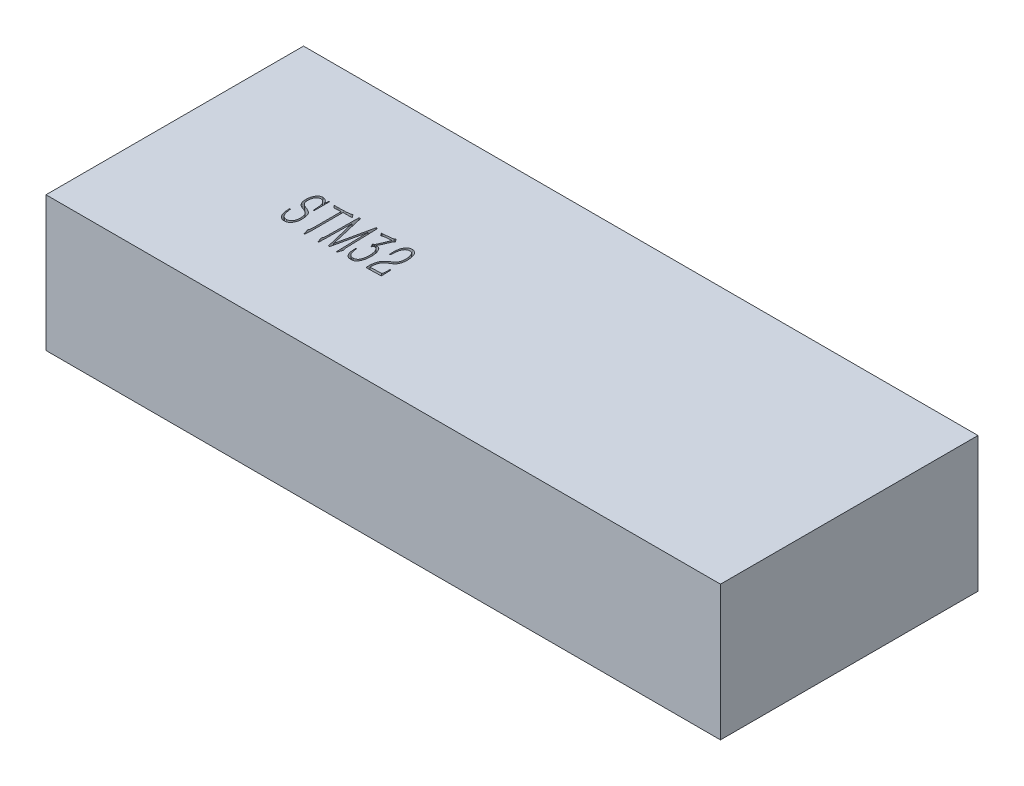
from build123d import *

# Parameters (mm, degrees)
SKETCH_1_W          = 55
SKETCH_1_H          = 21
EXTRUDE_1_DEPTH     = 11
CUT_EXTRUDE_1_DEPTH = 2


with BuildPart() as part:
    # 草图1 → 凸台-拉伸1 (new body)
    with BuildSketch(Plane(origin=(0, 0, 0), x_dir=(1, 0, 0), z_dir=(0, 1, 0))):
        Rectangle(SKETCH_1_W, SKETCH_1_H)
    extrude(amount=EXTRUDE_1_DEPTH)

    # 草图2 → 切除-拉伸1 (cut)
    with BuildSketch(Plane(origin=(0, 11, 0), x_dir=(1, 0, 0), z_dir=(0, 1, 0))):
        with BuildLine():
            Line((-15.545726401, 0.272778651), (-15.495012572, 0.580044792))
            Line((-15.495012572, 0.580044792), (-15.445044534, 0.574824251))
            Line((-15.445044534, 0.574824251), (-15.445044534, -0.683326186))
            Line((-15.445044534, -0.683326186), (-15.505453654, -0.688546727))
            Line((-15.505453654, -0.688546727), (-15.54050586, -0.15530573))
            add(Edge.make_bspline(
                [(-15.54050586, -0.15530573), (-15.545120979, -0.125653537), (-15.553652171, -0.070840527), (-15.570375119, 0.003388602), (-15.585885686, 0.064132898), (-15.60992007, 0.125691805), (-15.645585765, 0.191413941), (-15.698121168, 0.261857732), (-15.761154224, 0.325313201), (-15.835904039, 0.375229564), (-15.916922097, 0.413379867), (-15.975170709, 0.420630339), (-16.003642446, 0.424174347)],
                knots=[0, 0, 0, 0, 1.116474761, 2.063838624, 2.831507158, 3.446633667, 4.518832044, 5.603216916, 6.708904972, 7.82779241, 8.938231816, 10, 10, 10, 10], degree=3))
            add(Edge.make_bspline(
                [(-16.003642446, 0.424174347), (-16.020605721, 0.423447236), (-16.055433312, 0.421954394), (-16.099151463, 0.411672424), (-16.136409888, 0.398035989), (-16.167222762, 0.380492305), (-16.201114315, 0.356995795), (-16.236518518, 0.327827061), (-16.272117942, 0.29449713), (-16.303691267, 0.255762697), (-16.331408441, 0.213346819), (-16.361130077, 0.152206722), (-16.390726277, 0.074279981), (-16.410291414, -0.006431397), (-16.418843362, -0.073901542), (-16.424096383, -0.13086507), (-16.427469619, -0.194799251), (-16.430429041, -0.263930122), (-16.427885653, -0.335151778), (-16.417623197, -0.404800149), (-16.399146827, -0.471065886), (-16.380546117, -0.512245668), (-16.371317707, -0.532676282)],
                knots=[0, 0, 0, 0, 0.864038106, 1.773971445, 2.275285977, 2.88209936, 3.574564674, 4.376127188, 5.218616224, 6.055847121, 6.916999662, 7.795414815, 9.515900782, 11.157236165, 12.013901558, 12.981067707, 14.072720019, 15.277182195, 16.507433409, 17.699229733, 18.858513907, 20, 20, 20, 20], degree=3))
            add(Edge.make_bspline(
                [(-16.371317707, -0.532676282), (-16.360869244, -0.551621911), (-16.340493141, -0.588568785), (-16.302385021, -0.63775803), (-16.257630675, -0.677624712), (-16.194768088, -0.71824204), (-16.119363047, -0.754543277), (-16.059926532, -0.77854607), (-16.03347411, -0.789228594)],
                knots=[0, 0, 0, 0, 0.892298636, 1.740118821, 2.553971753, 3.353728668, 4.822268012, 6, 6, 6, 6], degree=3))
            Line((-16.03347411, -0.789228594), (-15.857467292, -0.860078796))
            add(Edge.make_bspline(
                [(-15.857467292, -0.860078796), (-15.835752482, -0.87009329), (-15.793941997, -0.889375559), (-15.735013974, -0.920050934), (-15.68166264, -0.950384812), (-15.620276832, -0.991470311), (-15.552636998, -1.045431435), (-15.485801386, -1.119851507), (-15.431491132, -1.204190544), (-15.397424367, -1.302528667), (-15.370592973, -1.409209074), (-15.352476138, -1.52510209), (-15.340514785, -1.651627752), (-15.335707041, -1.78699432), (-15.337836275, -1.926879032), (-15.355717701, -2.018196036), (-15.364499041, -2.063040654)],
                knots=[0, 0, 0, 0, 0.703245545, 1.354054533, 1.953549274, 2.507188807, 3.525842386, 4.488918984, 5.43838142, 6.454223102, 7.53246407, 8.673253088, 9.899948524, 11.268249991, 12.658472344, 14, 14, 14, 14], degree=3))
            add(Edge.make_bspline(
                [(-15.364499041, -2.063040654), (-15.375478458, -2.108014042), (-15.396744921, -2.195124765), (-15.442755466, -2.295208406), (-15.483086666, -2.365981189), (-15.512964946, -2.411846993), (-15.542841349, -2.451262441), (-15.58188771, -2.497519015), (-15.642108178, -2.546279928), (-15.712367212, -2.585108604), (-15.777040362, -2.609249164), (-15.830721407, -2.623050475), (-15.888357879, -2.63004591), (-15.928053201, -2.631389259), (-15.948453868, -2.632079649)],
                knots=[0, 0, 0, 0, 1.868422262, 3.619020558, 4.429541533, 5.162879566, 5.830420081, 6.429075538, 7.606854402, 8.938752151, 9.657684361, 10.394048182, 11.174651193, 12, 12, 12, 12], degree=3))
            add(Edge.make_bspline(
                [(-15.948453868, -2.632079649), (-15.97136282, -2.631933914), (-16.016202718, -2.631648667), (-16.081806483, -2.621037822), (-16.143714519, -2.601617245), (-16.201364512, -2.572741374), (-16.255282029, -2.536675352), (-16.305357401, -2.493892905), (-16.351669384, -2.444845493), (-16.395401464, -2.390481897), (-16.433707271, -2.329095792), (-16.468320405, -2.262332489), (-16.497926072, -2.189848634), (-16.531118605, -2.087549624), (-16.56028594, -1.957593639), (-16.568628609, -1.852380075), (-16.572681441, -1.801267801)],
                knots=[0, 0, 0, 0, 0.833862414, 1.63212638, 2.411403016, 3.189256699, 3.973153178, 4.770028097, 5.583768076, 6.428386665, 7.307987397, 8.215552436, 9.166047206, 10.157242313, 12.13320567, 14, 14, 14, 14], degree=3))
            Line((-16.572681441, -1.801267801), (-16.592817814, -1.534274407))
            Line((-16.592817814, -1.534274407), (-16.521967611, -1.534274407))
            add(Edge.make_bspline(
                [(-16.521967611, -1.534274407), (-16.517892088, -1.565867601), (-16.510051357, -1.626648435), (-16.4962746, -1.714325665), (-16.482995543, -1.795147118), (-16.46602113, -1.891736073), (-16.439466365, -2.000843932), (-16.397632102, -2.119417828), (-16.343002913, -2.223476033), (-16.284637844, -2.296573811), (-16.234445776, -2.347428978), (-16.19443194, -2.376625966), (-16.155453469, -2.401848059), (-16.102626388, -2.423420595), (-16.036803822, -2.440657247), (-15.983863095, -2.440491643), (-15.958149158, -2.440411206)],
                knots=[0, 0, 0, 0, 1.134650933, 2.182907786, 3.161205505, 4.052250561, 5.675932663, 7.155002512, 8.52184542, 9.839854562, 10.472309825, 11.060302883, 11.600982628, 12.120735338, 13.087218943, 14, 14, 14, 14], degree=3))
            add(Edge.make_bspline(
                [(-15.958149158, -2.440411206), (-15.935452235, -2.439599929), (-15.891913495, -2.438043683), (-15.829650689, -2.42482848), (-15.772932978, -2.404576341), (-15.722958374, -2.373491794), (-15.678140584, -2.335971266), (-15.637700555, -2.292087322), (-15.600637256, -2.242659406), (-15.569730011, -2.187168973), (-15.542444046, -2.129809318), (-15.520017895, -2.07279896), (-15.503382594, -2.017135214), (-15.4921044, -1.962187229), (-15.484454926, -1.905365069), (-15.480556711, -1.844830094), (-15.477713804, -1.779153065), (-15.479279583, -1.733898767), (-15.48009674, -1.710281226)],
                knots=[0, 0, 0, 0, 1.108065456, 2.12556444, 3.098260599, 4.035950869, 4.98490885, 5.94776606, 6.946521194, 7.996930623, 9.045863326, 10.049925535, 10.987930625, 11.881525266, 12.788809675, 13.787786499, 14.845478855, 16, 16, 16, 16], degree=3))
            add(Edge.make_bspline(
                [(-15.48009674, -1.710281226), (-15.482707716, -1.673419561), (-15.487580906, -1.604620057), (-15.503383523, -1.509928575), (-15.522673874, -1.430391778), (-15.548415258, -1.365015626), (-15.579688609, -1.310965324), (-15.61255593, -1.262382964), (-15.649601102, -1.219062678), (-15.691810149, -1.18132547), (-15.738182166, -1.146342538), (-15.790394757, -1.113810968), (-15.848875154, -1.082908428), (-15.890874239, -1.065335624), (-15.912655871, -1.056221988)],
                knots=[0, 0, 0, 0, 1.578487453, 2.946127177, 4.097996722, 5.070650713, 5.936469873, 6.761635482, 7.575228913, 8.364955199, 9.176673428, 10.055112166, 10.991339211, 12, 12, 12, 12], degree=3))
            Line((-15.912655871, -1.056221988), (-16.129681227, -0.975676495))
            add(Edge.make_bspline(
                [(-16.129681227, -0.975676495), (-16.163452205, -0.96091396), (-16.230372316, -0.93166072), (-16.321712596, -0.872496394), (-16.401303358, -0.800874915), (-16.465395672, -0.713936779), (-16.5146133, -0.612713596), (-16.54468236, -0.517880559), (-16.561430498, -0.432680254), (-16.568882054, -0.360057104), (-16.573777286, -0.280167206), (-16.573058352, -0.224672432), (-16.572681441, -0.195578477)],
                knots=[0, 0, 0, 0, 1.141640751, 2.262259852, 3.359181592, 4.444772656, 5.58953336, 6.835542724, 7.519006772, 8.279340868, 9.097919025, 10, 10, 10, 10], degree=3))
            add(Edge.make_bspline(
                [(-16.572681441, -0.195578477), (-16.572468898, -0.170461033), (-16.572058036, -0.121906824), (-16.566836172, -0.051664567), (-16.557963401, 0.013073148), (-16.542065385, 0.092106688), (-16.513616721, 0.18492111), (-16.46942435, 0.288825364), (-16.418213621, 0.381634216), (-16.359340685, 0.459461193), (-16.292126294, 0.520310992), (-16.230932026, 0.562435919), (-16.175342084, 0.587454941), (-16.127674647, 0.600982501), (-16.074692853, 0.607870475), (-16.037717327, 0.609191803), (-16.018558278, 0.609876456)],
                knots=[0, 0, 0, 0, 0.971164436, 1.877345498, 2.721647718, 3.496542433, 4.992871533, 6.466013358, 7.856401207, 9.083219229, 10.219456221, 11.349985082, 11.939558551, 12.569451447, 13.258754286, 14, 14, 14, 14], degree=3))
            add(Edge.make_bspline(
                [(-16.018558278, 0.609876456), (-15.997084088, 0.607433607), (-15.95437485, 0.602575113), (-15.89173061, 0.585596928), (-15.831129529, 0.56121916), (-15.774533565, 0.528125929), (-15.72248285, 0.491277435), (-15.67564842, 0.453030371), (-15.637369715, 0.411647736), (-15.616304478, 0.382372297), (-15.606135521, 0.368239976)],
                knots=[0, 0, 0, 0, 1.049956055, 2.088219507, 3.145806661, 4.218152357, 5.268178035, 6.24663062, 7.15358473, 8, 8, 8, 8], degree=3))
            Line((-15.606135521, 0.368239976), (-15.545726401, 0.272778651))
        make_face()
        with BuildLine():
            Line((-14.133942894, 0.348103603), (-14.133942894, -2.077956487))
            Line((-14.133942894, -2.077956487), (-14.159299808, -2.576145278))
            add(Edge.make_bspline(
                [(-14.159299808, -2.576145278), (-14.159598209, -2.600377953), (-14.160133601, -2.643856455), (-14.168563762, -2.693031821), (-14.17675315, -2.723708784), (-14.182506683, -2.735483575), (-14.187975315, -2.745527316), (-14.192509124, -2.743344195), (-14.194352014, -2.742456806)],
                knots=[0, 0, 0, 0, 2.43675652, 4.372052466, 5.078871199, 5.550454925, 5.817270194, 6, 6, 6, 6], degree=3))
            add(Edge.make_bspline(
                [(-14.194352014, -2.742456806), (-14.196609085, -2.741778683), (-14.202171392, -2.740107521), (-14.213118622, -2.733997853), (-14.224282951, -2.714773084), (-14.235074558, -2.686138484), (-14.247159127, -2.653672236), (-14.252449231, -2.631380562), (-14.254761134, -2.621638566)],
                knots=[0, 0, 0, 0, 0.30288637, 0.746430801, 1.570370807, 3.058663464, 4.714565407, 6, 6, 6, 6], degree=3))
            Line((-14.254761134, -2.621638566), (-14.315170254, -2.440411206))
            add(Edge.make_bspline(
                [(-14.315170254, -2.440411206), (-14.320947349, -2.424527366), (-14.331103186, -2.396604386), (-14.343593289, -2.35997794), (-14.350187736, -2.333866008), (-14.352233431, -2.310851551), (-14.342101732, -2.286708012), (-14.330084437, -2.255223705), (-14.31670834, -2.218483973), (-14.306845661, -2.177753628), (-14.300550197, -2.133232653), (-14.294327892, -2.081265757), (-14.288361299, -2.016092298), (-14.281759409, -1.934584121), (-14.275096429, -1.83716293), (-14.274966096, -1.767223914), (-14.274897507, -1.730417599)],
                knots=[0, 0, 0, 0, 0.980641267, 1.723917205, 2.241620292, 2.544775778, 3.041991924, 3.722164793, 4.515637936, 5.302532678, 6.148880555, 7.121858782, 8.338588997, 9.944421189, 11.865699026, 14, 14, 14, 14], degree=3))
            Line((-14.274897507, -1.730417599), (-14.274897507, 0.343628853))
            add(Edge.make_bspline(
                [(-14.274897507, 0.343628853), (-14.289075041, 0.343566677), (-14.315213007, 0.343452049), (-14.348977405, 0.340840806), (-14.381315662, 0.338928011), (-14.418848176, 0.335816213), (-14.470804227, 0.331341161), (-14.531410294, 0.325519716), (-14.590913297, 0.321311333), (-14.638307783, 0.316336457), (-14.668910323, 0.314075978), (-14.683590784, 0.313290766), (-14.688066056, 0.313051398)],
                knots=[0, 0, 0, 0, 1.025992475, 1.891538789, 2.450608741, 3.371279513, 4.617765367, 6.225964987, 7.778834079, 8.935698997, 9.675552692, 10, 10, 10, 10], degree=3))
            Line((-14.688066056, 0.313051398), (-14.788747923, 0.298135565))
            Line((-14.788747923, 0.298135565), (-14.9595342, 0.44431072))
            add(Edge.make_bspline(
                [(-14.9595342, 0.44431072), (-14.967634208, 0.452157247), (-14.980149415, 0.464280805), (-14.991933044, 0.484285113), (-14.988341813, 0.497793867), (-14.982925112, 0.50892385), (-14.967840177, 0.514378725), (-14.95652099, 0.514401617), (-14.949838909, 0.514415131)],
                knots=[0, 0, 0, 0, 1.88901374, 2.918688365, 3.546721585, 4.117087209, 4.888455958, 6, 6, 6, 6], degree=3))
            add(Edge.make_bspline(
                [(-14.949838909, 0.514415131), (-14.946619655, 0.513584962), (-14.935904757, 0.510821847), (-14.912231318, 0.510909246), (-14.875314083, 0.508471801), (-14.845941506, 0.508930401), (-14.829020669, 0.50919459)],
                knots=[0, 0, 0, 0, 0.328519165, 1.093436259, 2.325598431, 4, 4, 4, 4], degree=3))
            Line((-14.829020669, 0.50919459), (-14.748475176, 0.50471984))
            add(Edge.make_bspline(
                [(-14.748475176, 0.50471984), (-14.745507486, 0.50384695), (-14.736061861, 0.501068696), (-14.715063593, 0.503365063), (-14.68285755, 0.501698821), (-14.65724953, 0.503619207), (-14.642572768, 0.50471984)],
                knots=[0, 0, 0, 0, 0.347341643, 1.105526146, 2.341086076, 4, 4, 4, 4], degree=3))
            Line((-14.642572768, 0.50471984), (-14.53667036, 0.50471984))
            Line((-14.53667036, 0.50471984), (-14.274897507, 0.514415131))
            Line((-14.274897507, 0.514415131), (-14.063838483, 0.519635672))
            add(Edge.make_bspline(
                [(-14.063838483, 0.519635672), (-14.045660299, 0.520304858), (-14.003394502, 0.521860773), (-13.935075122, 0.533032156), (-13.858614602, 0.543686551), (-13.794209098, 0.551365302), (-13.747441511, 0.555274986), (-13.721219802, 0.560137133), (-13.70283532, 0.563615948), (-13.694132919, 0.567997473), (-13.690942681, 0.56960371)],
                knots=[0, 0, 0, 0, 1.156915626, 2.689925566, 4.399695503, 6.072075551, 6.820020126, 7.381954211, 7.77342877, 8, 8, 8, 8], degree=3))
            Line((-13.690942681, 0.56960371), (-13.585040273, 0.609876456))
            Line((-13.585040273, 0.609876456), (-13.43961091, 0.428649096))
            add(Edge.make_bspline(
                [(-13.43961091, 0.428649096), (-13.432887094, 0.419203063), (-13.422245227, 0.404252707), (-13.411916073, 0.384246226), (-13.410595086, 0.37151166), (-13.41293507, 0.362370021), (-13.422257814, 0.360094746), (-13.434065581, 0.360326179), (-13.452279964, 0.35780247), (-13.466463539, 0.358272791), (-13.474663115, 0.358544685)],
                knots=[0, 0, 0, 0, 2.075716626, 3.285262792, 3.906827215, 4.383787294, 4.762155351, 5.472092002, 6.53860716, 8, 8, 8, 8], degree=3))
            Line((-13.474663115, 0.358544685), (-13.580565523, 0.358544685))
            Line((-13.580565523, 0.358544685), (-13.957936075, 0.353324144))
            add(Edge.make_bspline(
                [(-13.957936075, 0.353324144), (-13.976828514, 0.354176131), (-14.010874857, 0.355711509), (-14.055865444, 0.356373024), (-14.089034301, 0.356379287), (-14.106853675, 0.354181635), (-14.11380652, 0.353324144)],
                knots=[0, 0, 0, 0, 1.454015493, 2.620302767, 3.461663352, 4, 4, 4, 4], degree=3))
            Line((-14.11380652, 0.353324144), (-14.133942894, 0.348103603))
        make_face()
        with BuildLine():
            Line((-11.710865971, 0.635233371), (-11.595268272, 0.635233371))
            Line((-11.595268272, 0.635233371), (-11.525163861, -1.725942849))
            Line((-11.525163861, -1.725942849), (-11.51994332, -1.947442956))
            add(Edge.make_bspline(
                [(-11.51994332, -1.947442956), (-11.519688411, -1.972055827), (-11.519255409, -2.013864594), (-11.515857026, -2.069996719), (-11.508136622, -2.11675285), (-11.498299544, -2.161206335), (-11.485271892, -2.203431982), (-11.471788973, -2.239705248), (-11.458039063, -2.266246338), (-11.450757489, -2.287284947), (-11.454203722, -2.307413183), (-11.460085063, -2.332969093), (-11.473862679, -2.369789276), (-11.483739799, -2.398627737), (-11.489365864, -2.415054292)],
                knots=[0, 0, 0, 0, 1.833532234, 3.114538037, 4.183068399, 5.360011406, 6.502211209, 7.47535404, 8.229329157, 8.745810393, 9.081162989, 9.727925243, 10.705812996, 12, 12, 12, 12], degree=3))
            Line((-11.489365864, -2.415054292), (-11.545300234, -2.586586361))
            add(Edge.make_bspline(
                [(-11.545300234, -2.586586361), (-11.551447574, -2.602274067), (-11.562311144, -2.629997359), (-11.577200143, -2.665584037), (-11.587660036, -2.689949607), (-11.597508687, -2.705568154), (-11.608038543, -2.713804802), (-11.620705226, -2.716657486), (-11.630412544, -2.708343849), (-11.63366994, -2.701115531), (-11.635541019, -2.696963518)],
                knots=[0, 0, 0, 0, 2.257142557, 3.988819353, 5.165733309, 5.812331029, 6.431774305, 6.935717094, 7.388666149, 8, 8, 8, 8], degree=3))
            add(Edge.make_bspline(
                [(-11.635541019, -2.696963518), (-11.638685774, -2.690861639), (-11.646688192, -2.675334265), (-11.646751107, -2.642563342), (-11.646686826, -2.598742053), (-11.642898212, -2.565219317), (-11.64076156, -2.546313614)],
                knots=[0, 0, 0, 0, 0.533370556, 1.357261302, 2.50958371, 4, 4, 4, 4], degree=3))
            Line((-11.64076156, -2.546313614), (-11.650456851, -2.229352182))
            Line((-11.650456851, -2.229352182), (-11.710865971, -0.049403322))
            Line((-11.710865971, -0.049403322), (-12.274684424, -2.606722734))
            Line((-12.274684424, -2.606722734), (-12.370891541, -2.601502193))
            Line((-12.370891541, -2.601502193), (-12.97945749, -0.079234986))
            Line((-12.97945749, -0.079234986), (-13.019730237, -2.253963305))
            Line((-13.019730237, -2.253963305), (-13.030171319, -2.566449987))
            add(Edge.make_bspline(
                [(-13.030171319, -2.566449987), (-13.030293637, -2.589135581), (-13.030512475, -2.629722364), (-13.03774409, -2.676310159), (-13.044880131, -2.705234603), (-13.050365888, -2.718272928), (-13.056726205, -2.727931672), (-13.062566604, -2.727663136), (-13.065223524, -2.727540974)],
                knots=[0, 0, 0, 0, 2.35867652, 4.21990684, 4.917432392, 5.427710553, 5.739653463, 6, 6, 6, 6], degree=3))
            add(Edge.make_bspline(
                [(-13.065223524, -2.727540974), (-13.068722531, -2.726942651), (-13.076046707, -2.72569023), (-13.089810817, -2.719486174), (-13.100250517, -2.696086428), (-13.109006712, -2.670407857), (-13.117027396, -2.645333989), (-13.121175187, -2.629297036), (-13.124792201, -2.619042737), (-13.125425594, -2.613692288), (-13.125632644, -2.611943275)],
                knots=[0, 0, 0, 0, 0.61831469, 1.294266409, 2.516485019, 4.811391437, 6.122679461, 7.065853468, 7.69463614, 8, 8, 8, 8], degree=3))
            Line((-13.125632644, -2.611943275), (-13.21661922, -2.385222628))
            add(Edge.make_bspline(
                [(-13.21661922, -2.385222628), (-13.219075454, -2.373847787), (-13.223899577, -2.351507235), (-13.222999802, -2.316091261), (-13.213471132, -2.278672403), (-13.19926351, -2.239741269), (-13.184808241, -2.204089779), (-13.17453907, -2.177929004), (-13.168707639, -2.157998201), (-13.166488054, -2.137874806), (-13.163093015, -2.111599064), (-13.161457081, -2.080685004), (-13.159596895, -2.049834244), (-13.1569146, -2.023289537), (-13.155889222, -2.003337662), (-13.154095131, -1.989469094), (-13.152999064, -1.97753922), (-13.152352145, -1.963357515), (-13.151823175, -1.942953688), (-13.149781907, -1.916395913), (-13.14978765, -1.883536029), (-13.14755551, -1.844792146), (-13.147489573, -1.799764528), (-13.146368656, -1.767704566), (-13.145769018, -1.750553972)],
                knots=[0, 0, 0, 0, 1.187984124, 2.333238898, 3.586201942, 5.123185855, 6.573707022, 7.523685523, 7.99901539, 8.693496643, 9.589827362, 10.711954829, 11.85946849, 12.753267707, 13.442133117, 13.902940376, 14.183976602, 14.668078378, 15.355532658, 16.272922794, 17.392740166, 18.716797284, 20.243638767, 22, 22, 22, 22], degree=3))
            Line((-13.145769018, -1.750553972), (-13.110716812, 0.635233371))
            Line((-13.110716812, 0.635233371), (-12.989898572, 0.635233371))
            Line((-12.989898572, 0.635233371), (-12.330618794, -2.213690559))
            Line((-12.330618794, -2.213690559), (-11.710865971, 0.635233371))
        make_face()
        with BuildLine():
            add(Edge.make_bspline(
                [(-10.586958023, -0.618442316), (-10.575786389, -0.595315272), (-10.554265696, -0.550764044), (-10.522875747, -0.486411102), (-10.493591786, -0.427327026), (-10.468545162, -0.372500568), (-10.445190324, -0.323140464), (-10.424389816, -0.278718297), (-10.406416776, -0.239219543), (-10.387494961, -0.195367469), (-10.367870149, -0.149619581), (-10.348871682, -0.104810692), (-10.335055774, -0.07280267), (-10.32791292, -0.055869754), (-10.325185169, -0.049403322)],
                knots=[0, 0, 0, 0, 1.475873638, 2.843077615, 4.114458223, 5.26483622, 6.306479236, 7.252326145, 8.083448402, 8.799989154, 9.996708352, 10.943956596, 11.596712522, 12, 12, 12, 12], degree=3))
            Line((-10.325185169, -0.049403322), (-10.164094183, 0.378681059))
            add(Edge.make_bspline(
                [(-10.164094183, 0.378681059), (-10.19913034, 0.375252368), (-10.275577506, 0.367771134), (-10.373137563, 0.361831018), (-10.454255255, 0.357505198), (-10.50991586, 0.352841075), (-10.558655668, 0.348481652), (-10.588702658, 0.345165028), (-10.602619646, 0.343628853)],
                knots=[0, 0, 0, 0, 1.440114021, 3.142257811, 3.998086789, 4.76330671, 5.427195687, 6, 6, 6, 6], degree=3))
            Line((-10.602619646, 0.343628853), (-10.75326955, 0.318271939))
            add(Edge.make_bspline(
                [(-10.75326955, 0.318271939), (-10.760000996, 0.316856763), (-10.778366216, 0.312995778), (-10.81232918, 0.302452622), (-10.86124212, 0.289486973), (-10.898471536, 0.27882444), (-10.919581078, 0.272778651)],
                knots=[0, 0, 0, 0, 0.478461291, 1.305373098, 2.472113022, 4, 4, 4, 4], degree=3))
            Line((-10.919581078, 0.272778651), (-10.969549116, 0.252642278))
            Line((-10.969549116, 0.252642278), (-11.095587897, 0.439090179))
            add(Edge.make_bspline(
                [(-11.095587897, 0.439090179), (-11.100910095, 0.446390007), (-11.109995654, 0.458851593), (-11.117538287, 0.476186914), (-11.123137085, 0.488230179), (-11.118119049, 0.500357763), (-11.09827626, 0.498539211), (-11.083294653, 0.487902512), (-11.064158953, 0.477668643), (-11.042142902, 0.476229312), (-11.015451651, 0.474662901), (-10.995889303, 0.477703269), (-10.985210739, 0.479362925)],
                knots=[0, 0, 0, 0, 1.323589942, 2.259509366, 2.829398404, 3.190947808, 3.965341466, 5.19662492, 6.050472624, 7.088782, 8.410843841, 10, 10, 10, 10], degree=3))
            Line((-10.985210739, 0.479362925), (-10.824119753, 0.484583467))
            Line((-10.824119753, 0.484583467), (-10.189451097, 0.559908419))
            Line((-10.189451097, 0.559908419), (-10.13948306, 0.605401707))
            Line((-10.13948306, 0.605401707), (-10.099210313, 0.645674453))
            add(Edge.make_bspline(
                [(-10.099210313, 0.645674453), (-10.097961337, 0.64418772), (-10.092841229, 0.638092941), (-10.081818552, 0.623590111), (-10.06221869, 0.600289371), (-10.047400322, 0.580871778), (-10.038801193, 0.56960371)],
                knots=[0, 0, 0, 0, 0.23984028, 0.983211964, 2.249351781, 4, 4, 4, 4], degree=3))
            Line((-10.038801193, 0.56960371), (-9.942594076, 0.44878547))
            add(Edge.make_bspline(
                [(-9.942594076, 0.44878547), (-9.936133617, 0.440397427), (-9.925397356, 0.42645783), (-9.91743233, 0.404164401), (-9.925594045, 0.389060089), (-9.936995468, 0.376112953), (-9.955477237, 0.360562451), (-9.97012044, 0.349741422), (-9.978392073, 0.343628853)],
                knots=[0, 0, 0, 0, 1.419029252, 2.358201718, 2.827787952, 3.596253847, 4.642174893, 6, 6, 6, 6], degree=3))
            Line((-9.978392073, 0.343628853), (-10.033580652, 0.298135565))
            add(Edge.make_bspline(
                [(-10.033580652, 0.298135565), (-10.049709186, 0.257602268), (-10.080310816, 0.180696026), (-10.124401701, 0.07124516), (-10.164746662, -0.026072394), (-10.200172333, -0.112106547), (-10.232711311, -0.185879439), (-10.259574159, -0.248477542), (-10.283759466, -0.298698917), (-10.298552465, -0.328097488), (-10.305048796, -0.34100784)],
                knots=[0, 0, 0, 0, 1.507300768, 2.859891598, 4.076963614, 5.147345159, 6.074452096, 6.862861548, 7.500626815, 8, 8, 8, 8], degree=3))
            Line((-10.305048796, -0.34100784), (-10.456444492, -0.628137607))
            add(Edge.make_bspline(
                [(-10.456444492, -0.628137607), (-10.438549033, -0.626708761), (-10.404276073, -0.623972269), (-10.351971303, -0.618748437), (-10.29498225, -0.625933771), (-10.244997922, -0.645924378), (-10.202469982, -0.670591257), (-10.168392336, -0.69522862), (-10.135836285, -0.727250297), (-10.102639121, -0.764894118), (-10.069364408, -0.809823972), (-10.038776475, -0.86424325), (-10.006934828, -0.9263852), (-9.96711318, -1.021088535), (-9.924084194, -1.147803529), (-9.897940481, -1.306958271), (-9.885023485, -1.466414953), (-9.883127178, -1.572533638), (-9.882184956, -1.625260983)],
                knots=[0, 0, 0, 0, 0.660541429, 1.265053373, 1.928435853, 2.750244091, 3.225390118, 3.735570922, 4.291687282, 4.900607759, 5.580848831, 6.342918567, 7.193367346, 8.147740655, 10.119512469, 12.097611575, 14.061014616, 16, 16, 16, 16], degree=3))
            add(Edge.make_bspline(
                [(-9.882184956, -1.625260983), (-9.884175319, -1.666540862), (-9.887956368, -1.744959378), (-9.897094268, -1.855770759), (-9.91073068, -1.952986687), (-9.930589782, -2.062589215), (-9.965612762, -2.183678439), (-10.008879209, -2.295394432), (-10.049960048, -2.375879447), (-10.084582063, -2.429248564), (-10.122503046, -2.476994061), (-10.163254088, -2.518776545), (-10.205643578, -2.55311298), (-10.246784517, -2.582643438), (-10.288414971, -2.603514607), (-10.342309321, -2.620950405), (-10.408169504, -2.632969008), (-10.460624307, -2.635376882), (-10.486276156, -2.636554398)],
                knots=[0, 0, 0, 0, 1.512752116, 2.8737433, 4.067977017, 5.104892351, 6.948544146, 8.672095895, 9.482011449, 10.251829035, 10.996496654, 11.710742831, 12.38300564, 12.991319199, 13.561044299, 14.079002633, 15.060579187, 16, 16, 16, 16], degree=3))
            add(Edge.make_bspline(
                [(-10.486276156, -2.636554398), (-10.508156091, -2.636927352), (-10.550250576, -2.637644871), (-10.611307523, -2.63267437), (-10.666916977, -2.621297801), (-10.71906941, -2.605821721), (-10.767911853, -2.581348093), (-10.814565834, -2.546387608), (-10.861531433, -2.503337792), (-10.906562043, -2.450507802), (-10.947774671, -2.389982128), (-10.983809907, -2.323032465), (-11.013750227, -2.250606622), (-11.043514683, -2.14753469), (-11.068742582, -2.015736014), (-11.073237, -1.909032256), (-11.075451524, -1.85645638)],
                knots=[0, 0, 0, 0, 0.828828519, 1.594571005, 2.314948186, 2.97625877, 3.650192192, 4.371738268, 5.178272596, 6.059897072, 6.995131469, 7.947518938, 8.935744196, 9.957858231, 12.008325587, 14, 14, 14, 14], degree=3))
            Line((-11.075451524, -1.85645638), (-11.080672065, -1.660313188))
            Line((-11.080672065, -1.660313188), (-11.025483486, -1.660313188))
            add(Edge.make_bspline(
                [(-11.025483486, -1.660313188), (-11.021263289, -1.689399663), (-11.013181236, -1.745102842), (-11.001424961, -1.825468373), (-10.989248649, -1.898726999), (-10.975526286, -1.985421586), (-10.95267213, -2.082770257), (-10.914169844, -2.187542839), (-10.861955353, -2.276069061), (-10.80064911, -2.349020742), (-10.728947807, -2.401972835), (-10.652190375, -2.435373916), (-10.573960696, -2.451144472), (-10.522128471, -2.45094841), (-10.496717239, -2.450852289)],
                knots=[0, 0, 0, 0, 0.994021113, 1.903638599, 2.746793397, 3.505624798, 4.871908371, 6.122639036, 7.264652637, 8.331625701, 9.323760524, 10.250011688, 11.142051883, 12, 12, 12, 12], degree=3))
            add(Edge.make_bspline(
                [(-10.496717239, -2.450852289), (-10.476274283, -2.449089439), (-10.436235039, -2.445636749), (-10.378173789, -2.432491997), (-10.324478812, -2.410063), (-10.274284679, -2.381381198), (-10.229104953, -2.34397914), (-10.188442956, -2.299907303), (-10.154007446, -2.247551016), (-10.115414938, -2.167396568), (-10.077908945, -2.056893073), (-10.049688664, -1.916534295), (-10.031325264, -1.773364615), (-10.02269824, -1.630911485), (-10.021522762, -1.490570418), (-10.033062649, -1.398721559), (-10.038801193, -1.353047047)],
                knots=[0, 0, 0, 0, 0.647840119, 1.268849254, 1.871153999, 2.479976942, 3.088343857, 3.716462885, 4.367721208, 5.059616847, 6.52246665, 8.039623249, 9.575767262, 11.078710543, 12.547304005, 14, 14, 14, 14], degree=3))
            add(Edge.make_bspline(
                [(-10.038801193, -1.353047047), (-10.046825375, -1.303816655), (-10.062687336, -1.2064995), (-10.099379112, -1.089690397), (-10.135510278, -1.002466324), (-10.167745552, -0.943945913), (-10.204282828, -0.89167334), (-10.245670263, -0.847831561), (-10.287625514, -0.81185455), (-10.329737397, -0.787847989), (-10.371325101, -0.77549473), (-10.397973553, -0.77821066), (-10.410951204, -0.779533303)],
                knots=[0, 0, 0, 0, 2.019199264, 3.991492233, 4.943861116, 5.841091039, 6.693606335, 7.520378909, 8.278781735, 8.923571305, 9.475785111, 10, 10, 10, 10], degree=3))
            Line((-10.410951204, -0.779533303), (-10.491496697, -0.789228594))
            Line((-10.491496697, -0.789228594), (-10.526548903, -0.854858255))
            add(Edge.make_bspline(
                [(-10.526548903, -0.854858255), (-10.531227428, -0.863037345), (-10.539383246, -0.877295507), (-10.550528085, -0.896141586), (-10.559429328, -0.907180169), (-10.566185574, -0.916696237), (-10.57595229, -0.913495019), (-10.582234258, -0.902556049), (-10.592276563, -0.886452352), (-10.59880899, -0.872621627), (-10.602619646, -0.864553546)],
                knots=[0, 0, 0, 0, 1.659028505, 2.892093886, 3.763458346, 4.288089223, 4.647361994, 5.327919393, 6.441255868, 8, 8, 8, 8], degree=3))
            Line((-10.602619646, -0.864553546), (-10.68316514, -0.708683101))
            add(Edge.make_bspline(
                [(-10.68316514, -0.708683101), (-10.688987124, -0.699724674), (-10.699136504, -0.684107581), (-10.694736473, -0.66630539), (-10.692860431, -0.658715063)],
                knots=[0, 0, 0, 0, 1.147259222, 2, 2, 2, 2], degree=3))
            Line((-10.692860431, -0.658715063), (-10.652587684, -0.643053439))
            Line((-10.652587684, -0.643053439), (-10.586958023, -0.618442316))
        make_face()
        with BuildLine():
            Line((-9.216193054, -0.693767269), (-9.292263797, -0.693767269))
            add(Edge.make_bspline(
                [(-9.292263797, -0.693767269), (-9.293831201, -0.669658014), (-9.296819333, -0.623695628), (-9.299902676, -0.558056353), (-9.301204788, -0.49912031), (-9.302509205, -0.427270367), (-9.300497466, -0.336658506), (-9.295095778, -0.263674158), (-9.292263797, -0.225410141)],
                knots=[0, 0, 0, 0, 0.927540379, 1.768282303, 2.522502339, 3.190652681, 4.527123766, 6, 6, 6, 6], degree=3))
            add(Edge.make_bspline(
                [(-9.292263797, -0.225410141), (-9.29030389, -0.197043863), (-9.286513654, -0.142186734), (-9.27651065, -0.063124228), (-9.264934143, 0.010140148), (-9.249883588, 0.079050702), (-9.229547808, 0.146486563), (-9.200597625, 0.214315417), (-9.164491293, 0.284860482), (-9.121832622, 0.355652427), (-9.075025984, 0.42245031), (-9.022487476, 0.476807558), (-8.967501656, 0.518238756), (-8.908998048, 0.542896631), (-8.85282611, 0.558230313), (-8.801601904, 0.570291887), (-8.755570325, 0.578721297), (-8.726487594, 0.579620898), (-8.712783721, 0.580044792)],
                knots=[0, 0, 0, 0, 1.238521709, 2.395159043, 3.470603583, 4.46912877, 5.466066804, 6.534123646, 7.677244524, 8.916145015, 10.13365226, 11.221244199, 12.198275335, 13.109907183, 13.966820176, 14.733954848, 15.403435577, 16, 16, 16, 16], degree=3))
            add(Edge.make_bspline(
                [(-8.712783721, 0.580044792), (-8.695319525, 0.57875711), (-8.660810815, 0.57621269), (-8.610049459, 0.564423696), (-8.561024408, 0.547425726), (-8.498319713, 0.517145705), (-8.424996666, 0.469670807), (-8.362618287, 0.407328404), (-8.31945422, 0.350262087), (-8.289049368, 0.301694239), (-8.26210587, 0.247461484), (-8.228269767, 0.168659446), (-8.192872498, 0.064088423), (-8.167345796, -0.067985503), (-8.150978705, -0.205138396), (-8.143490239, -0.345349957), (-8.142097839, -0.484179574), (-8.150249572, -0.574721998), (-8.154185809, -0.618442316)],
                knots=[0, 0, 0, 0, 0.570779476, 1.127842599, 1.694919432, 2.261066821, 3.397481896, 4.527710891, 5.118384485, 5.730727279, 6.394748858, 7.092559246, 8.529363642, 9.986910621, 11.474321506, 13.03467297, 14.568129345, 16, 16, 16, 16], degree=3))
            add(Edge.make_bspline(
                [(-8.154185809, -0.618442316), (-8.162165183, -0.663414564), (-8.178242986, -0.754030053), (-8.212872672, -0.863129851), (-8.245168781, -0.946073815), (-8.272170022, -1.001654719), (-8.301020582, -1.050859307), (-8.342738319, -1.109048608), (-8.406446752, -1.175099968), (-8.46548301, -1.219394775), (-8.496504155, -1.242669889)],
                knots=[0, 0, 0, 0, 1.490916612, 3.004077927, 3.729534125, 4.397912905, 5.020560084, 5.590839424, 6.734084393, 8, 8, 8, 8], degree=3))
            Line((-8.496504155, -1.242669889), (-8.743361176, -1.398540335))
            add(Edge.make_bspline(
                [(-8.743361176, -1.398540335), (-8.77481818, -1.419896099), (-8.834466664, -1.460390705), (-8.914113856, -1.526536739), (-8.980964357, -1.596232823), (-9.031493451, -1.673296071), (-9.070738363, -1.75262187), (-9.105586595, -1.832272727), (-9.131895239, -1.920066304), (-9.15060697, -1.998758158), (-9.163367751, -2.064847477), (-9.169759881, -2.110939578), (-9.174952622, -2.15167634), (-9.175611235, -2.17713316), (-9.175920307, -2.189079436)],
                knots=[0, 0, 0, 0, 1.453572249, 2.75625039, 3.953730064, 5.132566341, 6.263730064, 7.337486329, 8.453238547, 9.76321854, 10.430854957, 11.026567013, 11.543191201, 12, 12, 12, 12], degree=3))
            Line((-9.175920307, -2.189079436), (-9.186361389, -2.40013846))
            Line((-9.186361389, -2.40013846), (-8.285445131, -2.370306796))
            add(Edge.make_bspline(
                [(-8.285445131, -2.370306796), (-8.273884853, -2.369660431), (-8.253580412, -2.368525158), (-8.234066598, -2.347251771), (-8.229723048, -2.321276951), (-8.22201569, -2.289328669), (-8.216285797, -2.243533658), (-8.211865585, -2.208707304), (-8.209374387, -2.189079436)],
                knots=[0, 0, 0, 0, 0.925905201, 1.626257371, 2.181371879, 3.087088273, 4.358305093, 6, 6, 6, 6], degree=3))
            Line((-8.209374387, -2.189079436), (-8.189238014, -1.750553972))
            Line((-8.189238014, -1.750553972), (-8.119133603, -1.750553972))
            Line((-8.119133603, -1.750553972), (-8.093776689, -2.415054292))
            add(Edge.make_bspline(
                [(-8.093776689, -2.415054292), (-8.092928993, -2.427972902), (-8.091446373, -2.450567565), (-8.090724654, -2.480457038), (-8.090704226, -2.501269561), (-8.091018995, -2.518073561), (-8.096431185, -2.532765616), (-8.101460198, -2.549813235), (-8.121077906, -2.559444336), (-8.149276969, -2.562525865), (-8.192133273, -2.566890141), (-8.225769122, -2.566611009), (-8.245172384, -2.566449987)],
                knots=[0, 0, 0, 0, 1.385018147, 2.4223982, 3.193529914, 3.619812046, 4.200562765, 4.878496499, 5.402948042, 6.404258339, 7.925751149, 10, 10, 10, 10], degree=3))
            Line((-8.245172384, -2.566449987), (-9.246770509, -2.591806902))
            add(Edge.make_bspline(
                [(-9.246770509, -2.591806902), (-9.258945949, -2.591842521), (-9.282944639, -2.591912728), (-9.307537632, -2.568048754), (-9.317861264, -2.53883461), (-9.323028201, -2.504472915), (-9.326489138, -2.458886322), (-9.328151559, -2.380480183), (-9.324597356, -2.268920297), (-9.316591616, -2.176865871), (-9.312400171, -2.128670316)],
                knots=[0, 0, 0, 0, 0.556373901, 1.096654043, 1.476064089, 2.012759395, 2.73145082, 3.635924119, 5.715166189, 8, 8, 8, 8], degree=3))
            add(Edge.make_bspline(
                [(-9.312400171, -2.128670316), (-9.308680611, -2.100538634), (-9.301515447, -2.046347251), (-9.286946992, -1.968341522), (-9.271414656, -1.895934742), (-9.254557973, -1.82917072), (-9.235949024, -1.768401182), (-9.215637408, -1.7136957), (-9.194581287, -1.664173216), (-9.162953902, -1.608150327), (-9.122757958, -1.547083492), (-9.077037278, -1.481238743), (-9.033017168, -1.425384714), (-8.975480739, -1.363936279), (-8.897587429, -1.296864701), (-8.832152094, -1.247753228), (-8.798549755, -1.222533516)],
                knots=[0, 0, 0, 0, 1.103491021, 2.125706759, 3.085324024, 3.98349739, 4.803138144, 5.555704107, 6.252741852, 6.89323317, 8.054555834, 9.09539633, 10.010480884, 10.817709087, 12.365830683, 14, 14, 14, 14], degree=3))
            Line((-8.798549755, -1.222533516), (-8.591965481, -1.091274194))
            add(Edge.make_bspline(
                [(-8.591965481, -1.091274194), (-8.575426199, -1.080277874), (-8.543687521, -1.059176072), (-8.499849666, -1.025580292), (-8.462476251, -0.99072228), (-8.430269059, -0.953105933), (-8.401113505, -0.909578485), (-8.377169196, -0.855322203), (-8.351855718, -0.791413527), (-8.322341607, -0.691983568), (-8.291910427, -0.560744764), (-8.280244811, -0.398594053), (-8.286476688, -0.234340458), (-8.305528712, -0.125320444), (-8.315276795, -0.069539696)],
                knots=[0, 0, 0, 0, 0.635613896, 1.219735276, 1.765761318, 2.268061313, 2.802129131, 3.435697723, 4.161225462, 5.001884758, 6.75303811, 8.46119913, 10.189351173, 12, 12, 12, 12], degree=3))
            add(Edge.make_bspline(
                [(-8.315276795, -0.069539696), (-8.322622141, -0.041102695), (-8.336948005, 0.014358899), (-8.364062745, 0.094253487), (-8.399161115, 0.167019558), (-8.436728632, 0.234994242), (-8.483793629, 0.294495577), (-8.546484914, 0.337229371), (-8.620546162, 0.365795926), (-8.674720098, 0.370826332), (-8.70308843, 0.373460518)],
                knots=[0, 0, 0, 0, 1.101106684, 2.147523679, 3.156537618, 4.125318695, 5.058520457, 5.968677808, 6.93629249, 8, 8, 8, 8], degree=3))
            add(Edge.make_bspline(
                [(-8.70308843, 0.373460518), (-8.718020826, 0.373613394), (-8.747804536, 0.373918317), (-8.792166058, 0.367191015), (-8.83531375, 0.353085698), (-8.891992167, 0.327520591), (-8.957485216, 0.279899717), (-9.026421578, 0.208048843), (-9.083283115, 0.12031736), (-9.127062143, 0.018652574), (-9.159980713, -0.097171332), (-9.186704147, -0.226978465), (-9.204251525, -0.372414936), (-9.209153962, -0.474209537), (-9.211718304, -0.527455741)],
                knots=[0, 0, 0, 0, 0.469335518, 0.936122588, 1.403629858, 1.893624907, 2.887406355, 3.927357629, 5.011993806, 6.157121359, 7.396943717, 8.794309501, 10.323183677, 12, 12, 12, 12], degree=3))
            Line((-9.211718304, -0.527455741), (-9.216193054, -0.693767269))
        make_face()
    extrude(amount=-CUT_EXTRUDE_1_DEPTH, mode=Mode.SUBTRACT)


solid = part.part
